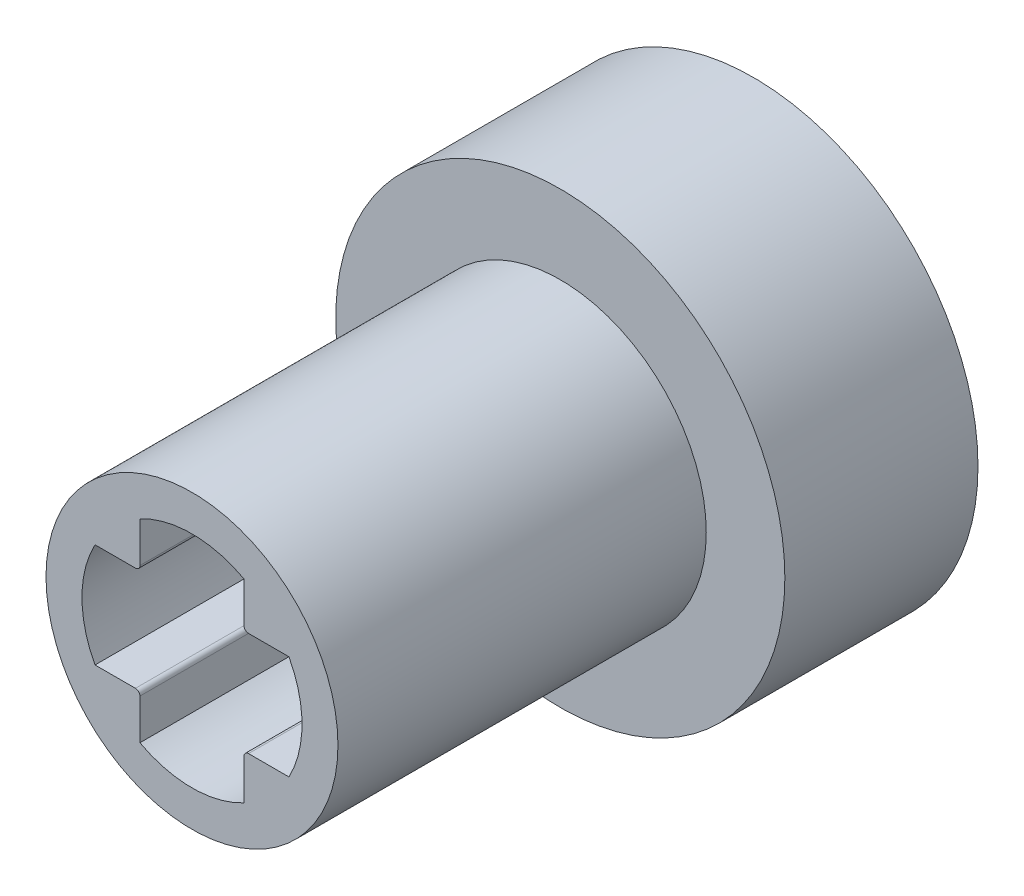
from build123d import *

# Parameters (mm, degrees)
SKETCH_1_R          = 5
SKETCH_1_R_2        = 1.15
EXTRUDE_1_DEPTH     = 12.5
CUT_EXTRUDE_START   = -8.2
SKETCH_2_R          = 5
SKETCH_2_R_2        = 3.25
CUT_EXTRUDE_5_DEPTH = 8.2
CUT_EXTRUDE_START_2 = -8
SKETCH_2_7_R        = 1.15
CUT_EXTRUDE_6_DEPTH = 8
FILLET_1_R          = 0.1


with BuildPart() as part:
    # 草图1 → 凸台-拉伸1 (new body)
    with BuildSketch(Plane.XY):
        Circle(SKETCH_1_R)
        Circle(SKETCH_1_R_2, mode=Mode.SUBTRACT)
    extrude(amount=EXTRUDE_1_DEPTH)

    # 草图2 → 切除-拉伸5 (cut)
    with BuildSketch(Plane.XY.offset(12.5).offset(CUT_EXTRUDE_START)):
        Circle(SKETCH_2_R)
        Circle(SKETCH_2_R_2, mode=Mode.SUBTRACT)
    extrude(amount=CUT_EXTRUDE_5_DEPTH, mode=Mode.SUBTRACT)

    # 草图2<7> → 切除-拉伸6 (cut)
    with BuildSketch(Plane.XY.offset(12.5).offset(CUT_EXTRUDE_START_2)):
        with BuildLine():
            Line((2.158689242, 1.158689242), (1.158689242, 1.158689242))
            Line((1.158689242, 1.158689242), (1.158689242, 2.158689242))
            ThreePointArc((1.158689242, 2.158689242), (0, 2.45), (-1.158689242, 2.158689242))
            Line((-1.158689242, 2.158689242), (-1.158689242, 1.158689242))
            Line((-1.158689242, 1.158689242), (-2.158689242, 1.158689242))
            ThreePointArc((-2.158689242, 1.158689242), (-2.45, 0), (-2.158689242, -1.158689242))
            Line((-2.158689242, -1.158689242), (-1.158689242, -1.158689242))
            Line((-1.158689242, -1.158689242), (-1.158689242, -2.158689242))
            ThreePointArc((-1.158689242, -2.158689242), (0, -2.45), (1.158689242, -2.158689242))
            Line((1.158689242, -2.158689242), (1.158689242, -1.158689242))
            Line((1.158689242, -1.158689242), (2.158689242, -1.158689242))
            ThreePointArc((2.158689242, -1.158689242), (2.376056464, -0.597373986), (2.45, 0))
            ThreePointArc((2.45, 0), (2.376056464, 0.597373986), (2.158689242, 1.158689242))
        make_face()
        Circle(SKETCH_2_7_R, mode=Mode.SUBTRACT)
    extrude(amount=CUT_EXTRUDE_6_DEPTH, mode=Mode.SUBTRACT)

    # 圆角1
    fillet_1_edges = [part.edges().sort_by_distance(p)[0] for p in [
        (1.158689242, -1.158689242, 8.5),
        (1.158689242, 1.158689242, 8.5),
        (-1.158689242, 1.158689242, 8.5),
        (-1.158689242, -1.158689242, 8.5),
    ]]
    fillet(fillet_1_edges, radius=FILLET_1_R)


solid = part.part
